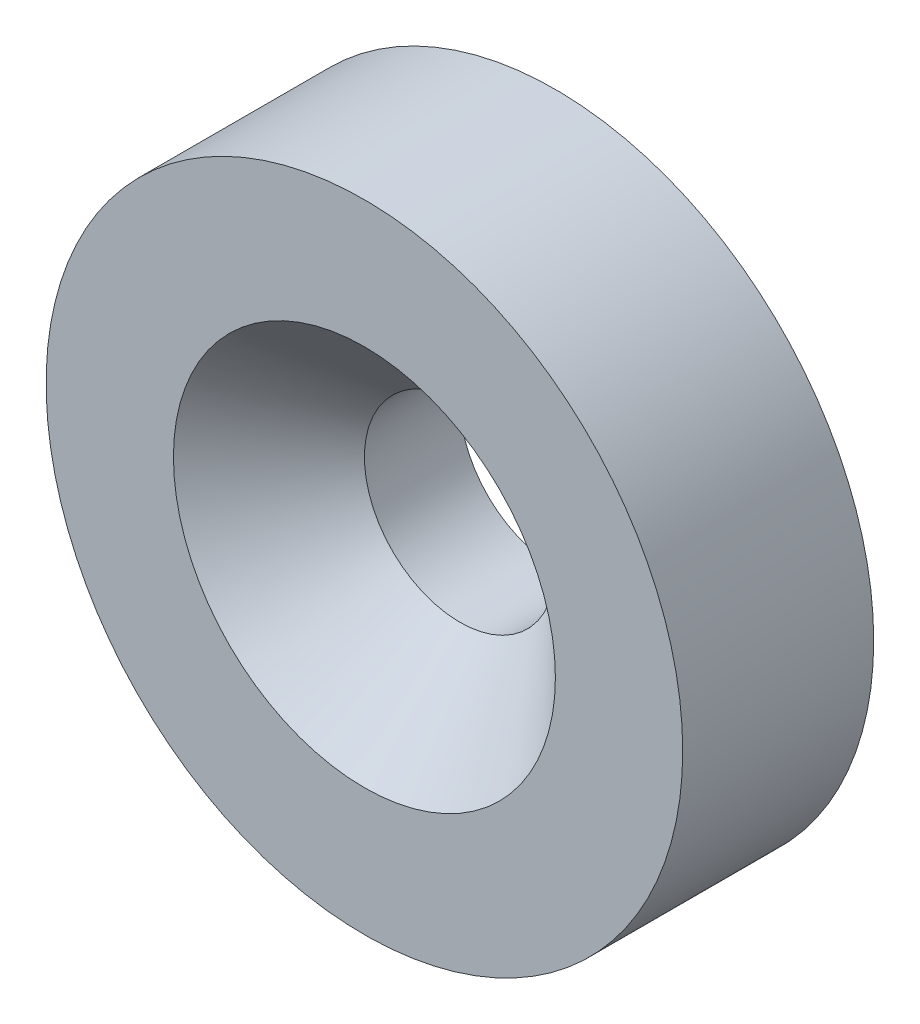
from build123d import *

# Parameters (mm, degrees)
SKETCH1_R           = 5
SKETCH1_R_2         = 1.5
BOSS_EXTRUDE1_DEPTH = 3
CHAMFER1_SIZE       = 1.5


with BuildPart() as part:
    # Sketch1 → Boss-Extrude1 (new body)
    with BuildSketch(Plane.XY):
        Circle(SKETCH1_R)
        Circle(SKETCH1_R_2, mode=Mode.SUBTRACT)
    extrude(amount=BOSS_EXTRUDE1_DEPTH)

    # Chamfer1
    chamfer1_edges = [part.edges().sort_by_distance(p)[0] for p in [
        (-1.5, 0, 3),
    ]]
    chamfer(chamfer1_edges, length=CHAMFER1_SIZE)


solid = part.part
